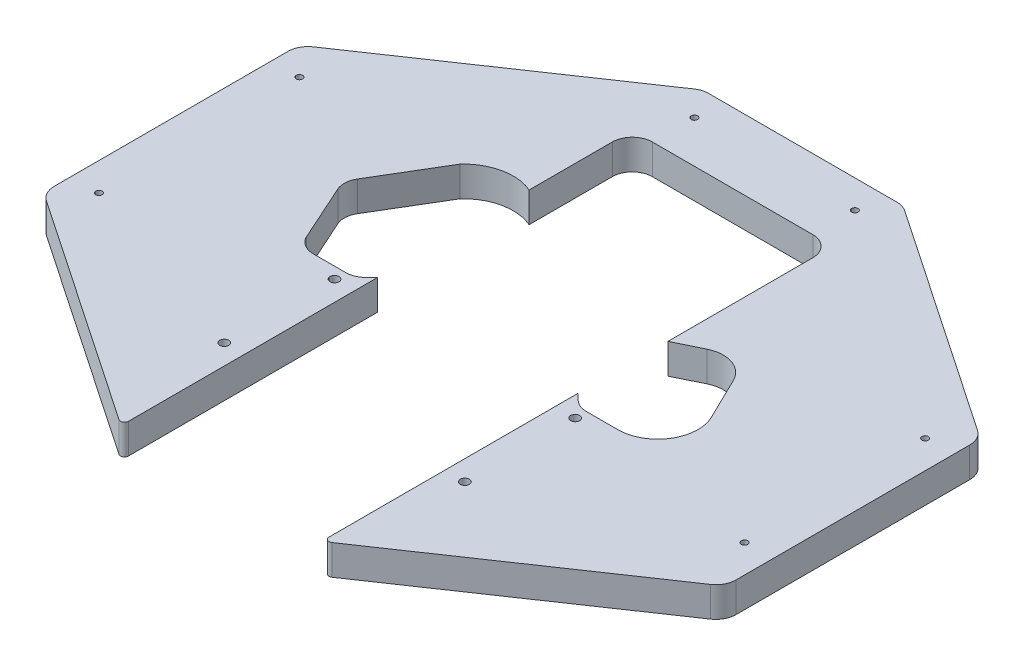
from build123d import *

# Parameters (mm, degrees)
BOSS_EXTRU_1_DEPTH       = 15
ESQUISSE6_W              = 100
ESQUISSE6_H              = 15
ENL_V_MAT_EXTRU_1_DEPTH  = 255
ENL_V_MAT_EXTRU_10_REACH = 393.106
ESQUISSE11_R             = 2.25
ENL_V_MAT_EXTRU_11_REACH = 393.106
ESQUISSE8_R              = 2.25
CONG_10_R                = 10
CONG_11_R                = 2
ENL_V_MAT_EXTRU_12_REACH = 391.991
ENL_V_MAT_EXTRU_13_REACH = 391.991
ESQUISSE13_W             = 20
ESQUISSE13_H             = 143.033455182
ESQUISSE13_H_2           = 181.308681646
CONG_12_R                = 10
ENL_V_MAT_EXTRU_14_REACH = 376.645
ESQUISSE14_R             = 1.6


with BuildPart() as part:
    # Esquisse1 → Boss.-Extru.1 (new body)
    with BuildSketch(Plane(origin=(0, 0, 0), x_dir=(1, 0, 0), z_dir=(0, 1, 0))):
        Polygon((-76.643189126, -51.401333399), (63.356810874, 43.598666601), (163.356810874, 43.598666601), (303.356810874, -51.401333399), (303.356810874, -151.401333399), (163.356810874, -246.401333399), (63.356810874, -246.401333399), (-76.643189126, -151.401333399), align=None)
    extrude(amount=BOSS_EXTRU_1_DEPTH)

    # Esquisse6 → Enlèv. mat.-Extru.1 (cut)
    with BuildSketch(Plane.XY.offset(246.401333399)):
        with Locations((113.356810874, 7.5)):
            Rectangle(ESQUISSE6_W, ESQUISSE6_H)
    extrude(amount=-ENL_V_MAT_EXTRU_1_DEPTH, mode=Mode.SUBTRACT)

    # Esquisse11 → Enlèv. mat.-Extru.10 (cut, up to next)
    with BuildSketch(Plane(origin=(0, 15, 0), x_dir=(1, 0, 0), z_dir=(0, 1, 0)), mode=Mode.PRIVATE) as enl_v_mat_extru_10_sk1:
        with Locations(Location((53.356810874, -129.901333399, 0), (0, 0, 270))):
            Circle(ESQUISSE11_R)
    enl_v_mat_extru_10_tool1 = extrude(enl_v_mat_extru_10_sk1.sketch, amount=-ENL_V_MAT_EXTRU_10_REACH, mode=Mode.PRIVATE) & part.part
    # Esquisse11 → Enlèv. mat.-Extru.10 (cut, up to next)
    with BuildSketch(Plane(origin=(0, 15, 0), x_dir=(1, 0, 0), z_dir=(0, 1, 0)), mode=Mode.PRIVATE) as enl_v_mat_extru_10_sk2:
        with Locations(Location((53.356810874, -184.901333399, 0), (0, 0, 270))):
            Circle(ESQUISSE11_R)
    enl_v_mat_extru_10_tool2 = extrude(enl_v_mat_extru_10_sk2.sketch, amount=-ENL_V_MAT_EXTRU_10_REACH, mode=Mode.PRIVATE) & part.part
    # Esquisse11 → Enlèv. mat.-Extru.10 (cut, up to next)
    with BuildSketch(Plane(origin=(0, 15, 0), x_dir=(1, 0, 0), z_dir=(0, 1, 0)), mode=Mode.PRIVATE) as enl_v_mat_extru_10_sk3:
        with Locations(Location((173.356810874, -129.901333399, 0), (0, 0, 270))):
            Circle(ESQUISSE11_R)
    enl_v_mat_extru_10_tool3 = extrude(enl_v_mat_extru_10_sk3.sketch, amount=-ENL_V_MAT_EXTRU_10_REACH, mode=Mode.PRIVATE) & part.part
    # Esquisse11 → Enlèv. mat.-Extru.10 (cut, up to next)
    with BuildSketch(Plane(origin=(0, 15, 0), x_dir=(1, 0, 0), z_dir=(0, 1, 0)), mode=Mode.PRIVATE) as enl_v_mat_extru_10_sk4:
        with Locations(Location((173.356810874, -184.901333399, 0), (0, 0, 270))):
            Circle(ESQUISSE11_R)
    enl_v_mat_extru_10_tool4 = extrude(enl_v_mat_extru_10_sk4.sketch, amount=-ENL_V_MAT_EXTRU_10_REACH, mode=Mode.PRIVATE) & part.part
    add(enl_v_mat_extru_10_tool1.solids().sort_by_distance((53.356811, 15, 129.901333))[0], mode=Mode.SUBTRACT)
    add(enl_v_mat_extru_10_tool2.solids().sort_by_distance((53.356811, 15, 184.901333))[0], mode=Mode.SUBTRACT)
    add(enl_v_mat_extru_10_tool3.solids().sort_by_distance((173.356811, 15, 129.901333))[0], mode=Mode.SUBTRACT)
    add(enl_v_mat_extru_10_tool4.solids().sort_by_distance((173.356811, 15, 184.901333))[0], mode=Mode.SUBTRACT)

    # Esquisse8 → Enlèv. mat.-Extru.11 (cut, up to next)
    with BuildSketch(Plane(origin=(0, 15, 0), x_dir=(1, 0, 0), z_dir=(0, 1, 0)), mode=Mode.PRIVATE) as enl_v_mat_extru_11_sk1:
        with Locations(Location((180.356810874, -120.901333399, 0), (0, 0, 270))):
            Circle(ESQUISSE8_R)
    enl_v_mat_extru_11_tool1 = extrude(enl_v_mat_extru_11_sk1.sketch, amount=-ENL_V_MAT_EXTRU_11_REACH, mode=Mode.PRIVATE) & part.part
    # Esquisse8 → Enlèv. mat.-Extru.11 (cut, up to next)
    with BuildSketch(Plane(origin=(0, 15, 0), x_dir=(1, 0, 0), z_dir=(0, 1, 0)), mode=Mode.PRIVATE) as enl_v_mat_extru_11_sk2:
        with Locations(Location((180.356810874, -81.901333399, 0), (0, 0, 270))):
            Circle(ESQUISSE8_R)
    enl_v_mat_extru_11_tool2 = extrude(enl_v_mat_extru_11_sk2.sketch, amount=-ENL_V_MAT_EXTRU_11_REACH, mode=Mode.PRIVATE) & part.part
    # Esquisse8 → Enlèv. mat.-Extru.11 (cut, up to next)
    with BuildSketch(Plane(origin=(0, 15, 0), x_dir=(1, 0, 0), z_dir=(0, 1, 0)), mode=Mode.PRIVATE) as enl_v_mat_extru_11_sk3:
        with Locations(Location((46.356810874, -120.901333399, 0), (0, 0, 270))):
            Circle(ESQUISSE8_R)
    enl_v_mat_extru_11_tool3 = extrude(enl_v_mat_extru_11_sk3.sketch, amount=-ENL_V_MAT_EXTRU_11_REACH, mode=Mode.PRIVATE) & part.part
    # Esquisse8 → Enlèv. mat.-Extru.11 (cut, up to next)
    with BuildSketch(Plane(origin=(0, 15, 0), x_dir=(1, 0, 0), z_dir=(0, 1, 0)), mode=Mode.PRIVATE) as enl_v_mat_extru_11_sk4:
        with Locations(Location((46.356810874, -81.901333399, 0), (0, 0, 270))):
            Circle(ESQUISSE8_R)
    enl_v_mat_extru_11_tool4 = extrude(enl_v_mat_extru_11_sk4.sketch, amount=-ENL_V_MAT_EXTRU_11_REACH, mode=Mode.PRIVATE) & part.part
    add(enl_v_mat_extru_11_tool1.solids().sort_by_distance((180.356811, 15, 120.901333))[0], mode=Mode.SUBTRACT)
    add(enl_v_mat_extru_11_tool2.solids().sort_by_distance((180.356811, 15, 81.901333))[0], mode=Mode.SUBTRACT)
    add(enl_v_mat_extru_11_tool3.solids().sort_by_distance((46.356811, 15, 120.901333))[0], mode=Mode.SUBTRACT)
    add(enl_v_mat_extru_11_tool4.solids().sort_by_distance((46.356811, 15, 81.901333))[0], mode=Mode.SUBTRACT)

    # Congé10
    cong_10_edges = [part.edges().sort_by_distance(p)[0] for p in [
        (-76.643189126, 7.5, 51.401333399),
        (63.356810874, 7.5, -43.598666601),
        (163.356810874, 7.5, -43.598666601),
        (303.356810874, 7.5, 51.401333399),
        (303.356810874, 7.5, 151.401333399),
        (-76.643189126, 7.5, 151.401333399),
        (63.356810874, 7.5, -8.598666601),
        (163.356810874, 7.5, -8.598666601),
    ]]
    fillet(cong_10_edges, radius=CONG_10_R)

    # Congé11
    cong_11_edges = [part.edges().sort_by_distance(p)[0] for p in [
        (163.356810874, 7.5, 246.401333399),
        (63.356810874, 7.5, 246.401333399),
    ]]
    fillet(cong_11_edges, radius=CONG_11_R)

    # Esquisse12 → Enlèv. mat.-Extru.12 (cut, up to next)
    with BuildSketch(Plane(origin=(0, 15, 0), x_dir=(1, 0, 0), z_dir=(0, 1, 0)), mode=Mode.PRIVATE) as enl_v_mat_extru_12_sk1:
        with BuildLine():
            Line((34.940182765, -48.918575783), (15.793326272, -80.935246354))
            ThreePointArc((15.793326272, -80.935246354), (14.39255048, -85.48771654), (15.256670784, -90.171780344))
            Line((15.256670784, -90.171780344), (27.943631129, -118.361875593))
            ThreePointArc((27.943631129, -118.361875593), (31.633138728, -122.655474578), (37.06267458, -124.257847507))
            Line((37.06267458, -124.257847507), (53.356810874, -124.257847507))
            ThreePointArc((53.356810874, -124.257847507), (57.183645198, -123.496642832), (60.427878686, -121.328915318))
            Line((60.427878686, -121.328915318), (63.356810874, -118.39998313))
            Line((63.356810874, -118.39998313), (63.356810874, -59.592280682))
            Line((63.356810874, -59.592280682), (64.824779414, -43.572926285))
            ThreePointArc((64.824779414, -43.572926285), (48.973323725, -41.163150472), (34.940182765, -48.918575783))
        make_face()
    enl_v_mat_extru_12_tool1 = extrude(enl_v_mat_extru_12_sk1.sketch, amount=-ENL_V_MAT_EXTRU_12_REACH, mode=Mode.PRIVATE) & part.part
    # Esquisse12 → Enlèv. mat.-Extru.12 (cut, up to next)
    with BuildSketch(Plane(origin=(0, 15, 0), x_dir=(1, 0, 0), z_dir=(0, 1, 0)), mode=Mode.PRIVATE) as enl_v_mat_extru_12_sk2:
        with BuildLine():
            Line((166.285743062, -121.328915318), (163.356810874, -118.39998313))
            Line((163.356810874, -118.39998313), (163.356810874, -73.642376596))
            Line((163.356810874, -73.642376596), (176.462200108, -67.250451181))
            ThreePointArc((176.462200108, -67.250451181), (187.921289626, -66.549583242), (196.519678004, -74.156794674))
            Line((196.519678004, -74.156794674), (206.924784537, -95.490424571))
            ThreePointArc((206.924784537, -95.490424571), (205.909865534, -114.856232791), (188.948903611, -124.257847507))
            Line((188.948903611, -124.257847507), (173.356810874, -124.257847507))
            ThreePointArc((173.356810874, -124.257847507), (169.529976551, -123.496642832), (166.285743062, -121.328915318))
        make_face()
    enl_v_mat_extru_12_tool2 = extrude(enl_v_mat_extru_12_sk2.sketch, amount=-ENL_V_MAT_EXTRU_12_REACH, mode=Mode.PRIVATE) & part.part
    add(enl_v_mat_extru_12_tool1.solids().sort_by_distance((43.224361, 15, 84.406415))[0], mode=Mode.SUBTRACT)
    add(enl_v_mat_extru_12_tool2.solids().sort_by_distance((183.873626, 15, 97.045657))[0], mode=Mode.SUBTRACT)

    # Esquisse13 → Enlèv. mat.-Extru.13 (cut, up to next)
    with BuildSketch(Plane(origin=(0, 15, 0), x_dir=(1, 0, 0), z_dir=(0, 1, 0)), mode=Mode.PRIVATE) as enl_v_mat_extru_13_sk1:
        with Locations((-66.643189126, -101.968599131)):
            Rectangle(ESQUISSE13_W, ESQUISSE13_H)
    enl_v_mat_extru_13_tool1 = extrude(enl_v_mat_extru_13_sk1.sketch, amount=-ENL_V_MAT_EXTRU_13_REACH, mode=Mode.PRIVATE) & part.part
    # Esquisse13 → Enlèv. mat.-Extru.13 (cut, up to next)
    with BuildSketch(Plane(origin=(0, 15, 0), x_dir=(1, 0, 0), z_dir=(0, 1, 0)), mode=Mode.PRIVATE) as enl_v_mat_extru_13_sk2:
        with Locations((293.356810874, -101.059068944)):
            Rectangle(ESQUISSE13_W, ESQUISSE13_H_2)
    enl_v_mat_extru_13_tool2 = extrude(enl_v_mat_extru_13_sk2.sketch, amount=-ENL_V_MAT_EXTRU_13_REACH, mode=Mode.PRIVATE) & part.part
    add(enl_v_mat_extru_13_tool1.solids().sort_by_distance((-66.643189, 15, 101.968599))[0], mode=Mode.SUBTRACT)
    add(enl_v_mat_extru_13_tool2.solids().sort_by_distance((293.356811, 15, 101.059069))[0], mode=Mode.SUBTRACT)

    # Congé12
    cong_12_edges = [part.edges().sort_by_distance(p)[0] for p in [
        (-56.643189126, 7.5, 37.829904828),
        (-56.643189126, 7.5, 164.97276197),
        (283.356810874, 7.5, 37.829904828),
        (283.356810874, 7.5, 164.97276197),
    ]]
    fillet(cong_12_edges, radius=CONG_12_R)

    # Esquisse14 → Enlèv. mat.-Extru.14 (cut, up to next)
    with BuildSketch(Plane(origin=(0, 15, 0), x_dir=(1, 0, 0), z_dir=(0, 1, 0)), mode=Mode.PRIVATE) as enl_v_mat_extru_14_sk1:
        with Locations(Location((-42.643189126, -51.403530316, 0), (0, 0, 270))):
            Circle(ESQUISSE14_R)
    enl_v_mat_extru_14_tool1 = extrude(enl_v_mat_extru_14_sk1.sketch, amount=-ENL_V_MAT_EXTRU_14_REACH, mode=Mode.PRIVATE) & part.part
    # Esquisse14 → Enlèv. mat.-Extru.14 (cut, up to next)
    with BuildSketch(Plane(origin=(0, 15, 0), x_dir=(1, 0, 0), z_dir=(0, 1, 0)), mode=Mode.PRIVATE) as enl_v_mat_extru_14_sk2:
        with Locations(Location((-42.643189126, -151.403530316, 0), (0, 0, 270))):
            Circle(ESQUISSE14_R)
    enl_v_mat_extru_14_tool2 = extrude(enl_v_mat_extru_14_sk2.sketch, amount=-ENL_V_MAT_EXTRU_14_REACH, mode=Mode.PRIVATE) & part.part
    # Esquisse14 → Enlèv. mat.-Extru.14 (cut, up to next)
    with BuildSketch(Plane(origin=(0, 15, 0), x_dir=(1, 0, 0), z_dir=(0, 1, 0)), mode=Mode.PRIVATE) as enl_v_mat_extru_14_sk3:
        with Locations(Location((73.359258963, 29.598666601, 0), (0, 0, 270))):
            Circle(ESQUISSE14_R)
    enl_v_mat_extru_14_tool3 = extrude(enl_v_mat_extru_14_sk3.sketch, amount=-ENL_V_MAT_EXTRU_14_REACH, mode=Mode.PRIVATE) & part.part
    # Esquisse14 → Enlèv. mat.-Extru.14 (cut, up to next)
    with BuildSketch(Plane(origin=(0, 15, 0), x_dir=(1, 0, 0), z_dir=(0, 1, 0)), mode=Mode.PRIVATE) as enl_v_mat_extru_14_sk4:
        with Locations(Location((153.359258963, 29.598666601, 0), (0, 0, 270))):
            Circle(ESQUISSE14_R)
    enl_v_mat_extru_14_tool4 = extrude(enl_v_mat_extru_14_sk4.sketch, amount=-ENL_V_MAT_EXTRU_14_REACH, mode=Mode.PRIVATE) & part.part
    # Esquisse14 → Enlèv. mat.-Extru.14 (cut, up to next)
    with BuildSketch(Plane(origin=(0, 15, 0), x_dir=(1, 0, 0), z_dir=(0, 1, 0)), mode=Mode.PRIVATE) as enl_v_mat_extru_14_sk5:
        with Locations(Location((269.356810874, -51.399136482, 0), (0, 0, 270))):
            Circle(ESQUISSE14_R)
    enl_v_mat_extru_14_tool5 = extrude(enl_v_mat_extru_14_sk5.sketch, amount=-ENL_V_MAT_EXTRU_14_REACH, mode=Mode.PRIVATE) & part.part
    # Esquisse14 → Enlèv. mat.-Extru.14 (cut, up to next)
    with BuildSketch(Plane(origin=(0, 15, 0), x_dir=(1, 0, 0), z_dir=(0, 1, 0)), mode=Mode.PRIVATE) as enl_v_mat_extru_14_sk6:
        with Locations(Location((269.356810874, -141.399136482, 0), (0, 0, 270))):
            Circle(ESQUISSE14_R)
    enl_v_mat_extru_14_tool6 = extrude(enl_v_mat_extru_14_sk6.sketch, amount=-ENL_V_MAT_EXTRU_14_REACH, mode=Mode.PRIVATE) & part.part
    add(enl_v_mat_extru_14_tool1.solids().sort_by_distance((-42.643189, 15, 51.40353))[0], mode=Mode.SUBTRACT)
    add(enl_v_mat_extru_14_tool2.solids().sort_by_distance((-42.643189, 15, 151.40353))[0], mode=Mode.SUBTRACT)
    add(enl_v_mat_extru_14_tool3.solids().sort_by_distance((73.359259, 15, -29.598667))[0], mode=Mode.SUBTRACT)
    add(enl_v_mat_extru_14_tool4.solids().sort_by_distance((153.359259, 15, -29.598667))[0], mode=Mode.SUBTRACT)
    add(enl_v_mat_extru_14_tool5.solids().sort_by_distance((269.356811, 15, 51.399136))[0], mode=Mode.SUBTRACT)
    add(enl_v_mat_extru_14_tool6.solids().sort_by_distance((269.356811, 15, 141.399136))[0], mode=Mode.SUBTRACT)


solid = part.part
